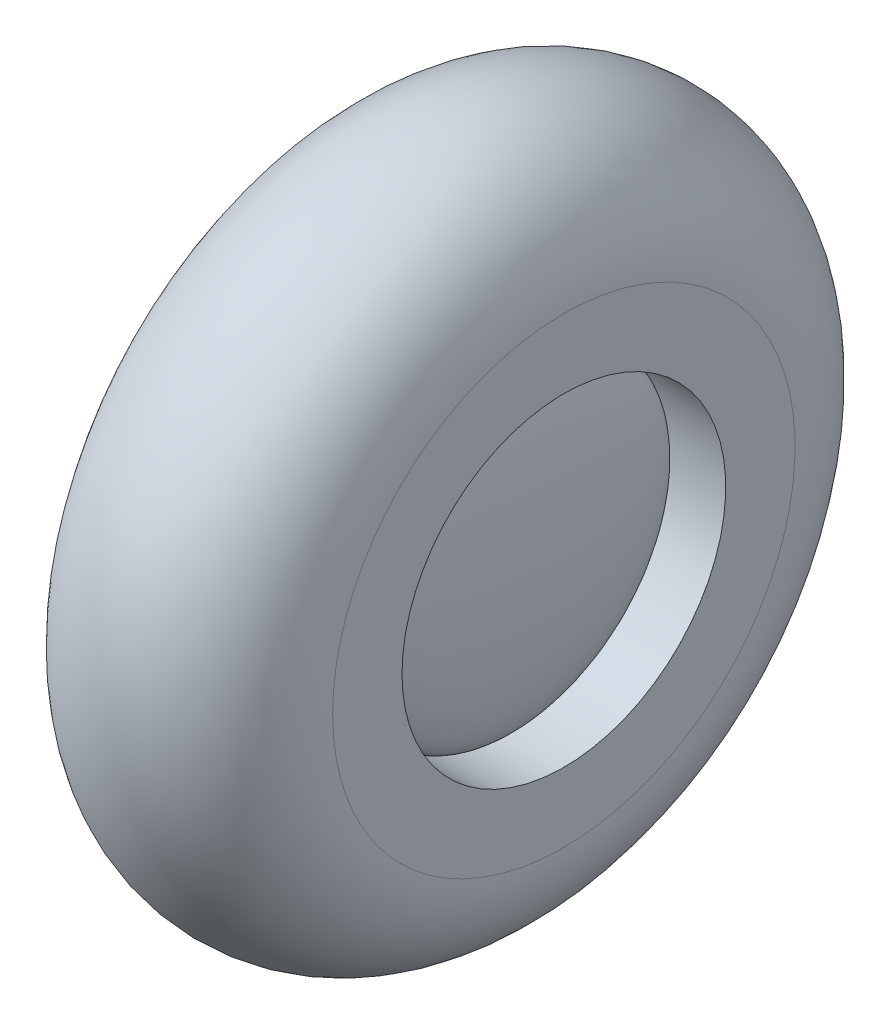
from build123d import *


with BuildPart() as part:
    # Sketch3 → Revolve1 (revolve)
    with BuildSketch(Plane.XY, mode=Mode.PRIVATE) as revolve1_sk:
        with BuildLine():
            Line((-82.8675, 0), (82.8675, 0))
            add(Edge.make_bspline(
                [(55.245, 150.6855), (77.69798373, 150.6855), (82.8675, 43.682715928), (82.8675, 0)],
                knots=[0, 0, 0, 0, 1, 1, 1, 1], degree=3))
            Line((55.245, 150.6855), (110.49, 150.6855))
            Line((110.49, 150.6855), (110.49, 215.265))
            ThreePointArc((110.49, 215.265), (0, 325.755), (-110.49, 215.265))
            Line((-110.49, 215.265), (-110.49, 150.6855))
            Line((-110.49, 150.6855), (-55.245, 150.6855))
            add(Edge.make_bspline(
                [(-55.245, 150.6855), (-77.69798373, 150.6855), (-82.8675, 43.682715928), (-82.8675, 0)],
                knots=[0, 0, 0, 0, 1, 1, 1, 1], degree=3))
        make_face()
    revolve(revolve1_sk.sketch.rotate(Axis((0, 0, 0), (1, 0, 0)), 90), axis=Axis((0, 0, 0), (1, 0, 0)))


solid = part.part
